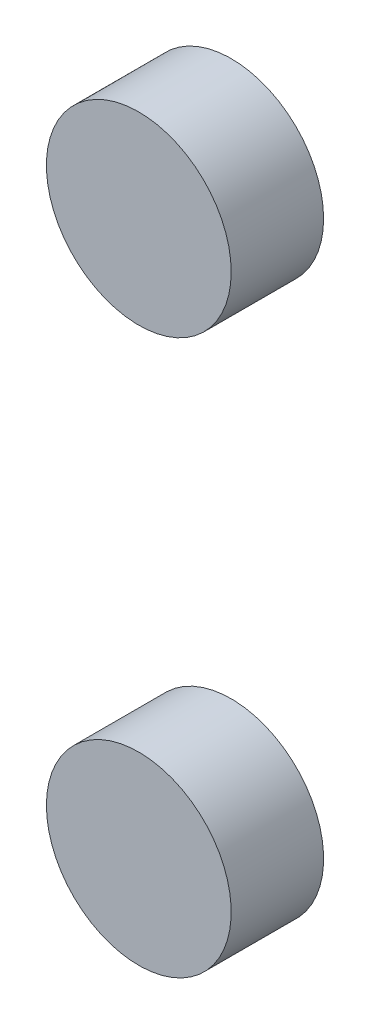
from build123d import *

# Parameters (mm, degrees)
SKETCH1_R             = 2
BOSS_EXTRUDE1_DEPTH   = 2
BOSS_EXTRUDE1_2_DEPTH = 2


with BuildPart() as part:
    # Sketch1 → Boss-Extrude1 (new body)
    with BuildSketch(Plane.XY):
        with Locations((0, 6)):
            Circle(SKETCH1_R)
    extrude(amount=BOSS_EXTRUDE1_DEPTH)


with BuildPart() as body_2:
    # Sketch1 → Boss-Extrude1 2 (new body)
    with BuildSketch(Plane.XY):
        with Locations(Location((0, -6, 0), (0, 0, 180))):
            Circle(SKETCH1_R)
    extrude(amount=BOSS_EXTRUDE1_2_DEPTH)


solid = Compound([part.part, body_2.part])
